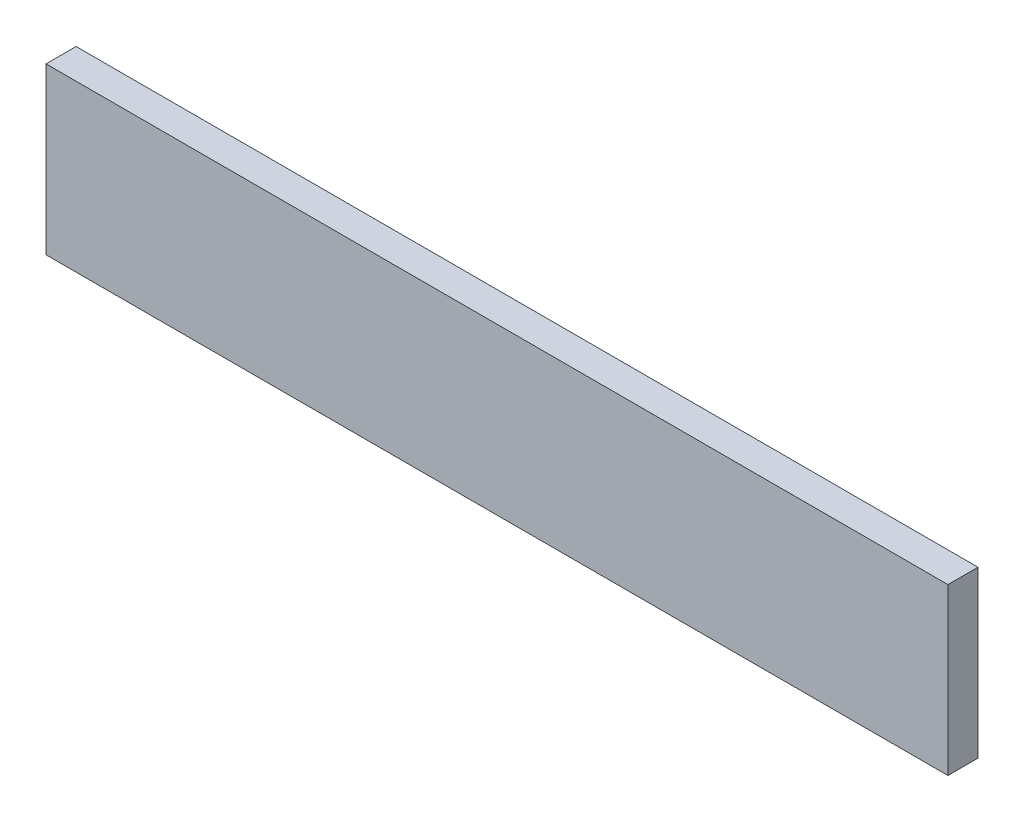
from build123d import *

# Parameters (mm, degrees)
ESQUISSE1_W        = 60
ESQUISSE1_H        = 11
BOSS_EXTRU_1_DEPTH = 2


with BuildPart() as part:
    # Esquisse1 → Boss.-Extru.1 (new body)
    with BuildSketch(Plane.XY):
        with Locations((30, 5.5)):
            Rectangle(ESQUISSE1_W, ESQUISSE1_H)
    extrude(amount=BOSS_EXTRU_1_DEPTH)


solid = part.part
